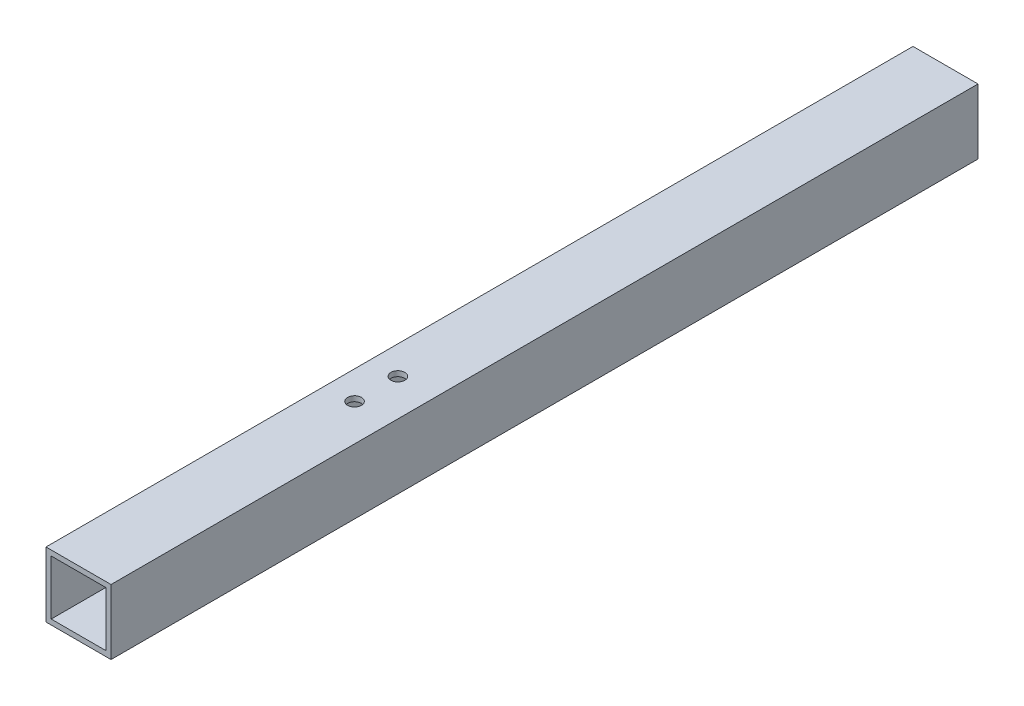
from build123d import *

# Parameters (mm, degrees)
SKETCH_1_W          = 15
SKETCH_1_H          = 15
SKETCH_1_W_2        = 12.6
SKETCH_1_H_2        = 12.6
EXTRUDE_1_DEPTH     = 200
SKETCH_2_R          = 1.6
CUT_EXTRUDE_1_DEPTH = 25


with BuildPart() as part:
    # 草图1 → 凸台-拉伸1 (new body)
    with BuildSketch(Plane.XY):
        Rectangle(SKETCH_1_W, SKETCH_1_H)
        Rectangle(SKETCH_1_W_2, SKETCH_1_H_2, mode=Mode.SUBTRACT)
    extrude(amount=EXTRUDE_1_DEPTH)

    # 草图2 → 切除-拉伸1 (cut)
    with BuildSketch(Plane.XZ.offset(7.5)):
        with Locations(Location((-1, 135.322387076, 0), (0, 0, 270))):
            Circle(SKETCH_2_R)
        with Locations(Location((-1, 125.322387076, 0), (0, 0, 270))):
            Circle(SKETCH_2_R)
    extrude(amount=-CUT_EXTRUDE_1_DEPTH, mode=Mode.SUBTRACT)


solid = part.part
